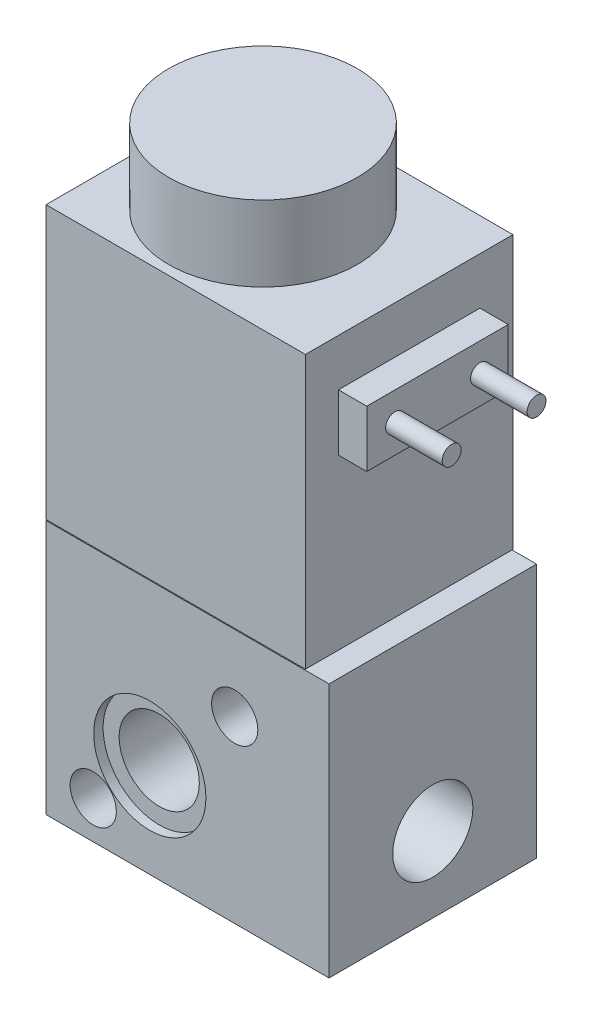
from build123d import *
from build123d.topology import SkipClean

# Parameters (mm, degrees)
ESQUISSE1_W             = 30
ESQUISSE1_H             = 27
ESQUISSE1_R             = 4.25
ESQUISSE1_R_2           = 1.5
BOSS_EXTRU_1_DEPTH      = 11
ESQUISSE1_W_2           = 27.5
ESQUISSE1_H_2           = 28.9
BOSS_EXTRU_1_2_DEPTH    = 11
ESQUISSE2_R             = 2.45
ENL_V_MAT_EXTRU_1_DEPTH = 8
ESQUISSE3_R             = 5.95
ENL_V_MAT_EXTRU_2_DEPTH = 1
ESQUISSE4_R             = 4.25
ENL_V_MAT_EXTRU_3_DEPTH = 8
ESQUISSE5_W             = 7.5
ESQUISSE5_H             = 6
BOSS_EXTRU_2_DEPTH      = 3
ESQUISSE6_R             = 1
BOSS_EXTRU_3_DEPTH      = 6
ESQUISSE9_R             = 10
BOSS_EXTRU_4_DEPTH      = 8


with BuildPart() as part:
    # Esquisse1 → Boss.-Extru.1 (new body)
    with BuildSketch(Plane.XY):
        with Locations((15, 13.5)):
            Rectangle(ESQUISSE1_W, ESQUISSE1_H)
        with Locations((11, 10)):
            Circle(ESQUISSE1_R, mode=Mode.SUBTRACT)
        with Locations((20, 19)):
            Circle(ESQUISSE1_R_2, mode=Mode.SUBTRACT)
        with Locations((5, 4)):
            Circle(ESQUISSE1_R_2, mode=Mode.SUBTRACT)
    extrude(amount=BOSS_EXTRU_1_DEPTH)

    # Esquisse2 → Enlèv. mat.-Extru.1 (cut)
    with BuildSketch(Plane.XY.offset(11)):
        with Locations((20, 19)):
            Circle(ESQUISSE2_R)
        with Locations((5, 4)):
            Circle(ESQUISSE2_R)
    extrude(amount=-ENL_V_MAT_EXTRU_1_DEPTH, mode=Mode.SUBTRACT)

    # Esquisse3 → Enlèv. mat.-Extru.2 (cut)
    with BuildSketch(Plane.XY.offset(11)):
        with Locations((11, 10)):
            Circle(ESQUISSE3_R)
    extrude(amount=-ENL_V_MAT_EXTRU_2_DEPTH, mode=Mode.SUBTRACT)

    # Esquisse4 → Enlèv. mat.-Extru.3 (cut)
    with BuildSketch(Plane(origin=(30, 0, 0), x_dir=(0, 0, -1), z_dir=(1, 0, 0))):
        with Locations((0, 8)):
            Circle(ESQUISSE4_R)
    extrude(amount=-ENL_V_MAT_EXTRU_3_DEPTH, mode=Mode.SUBTRACT)

    # Esquisse7 → Trou taraudé M4x0.71 (revolve, cut)
    with BuildSketch(Plane(origin=(25, 0, 7.5), x_dir=(0, 0, -1), z_dir=(1, 0, 0))):
        Polygon((0, 0), (0, 13.491420021), (1.65, 12.5), (1.65, 0), align=None)
    revolve(axis=Axis((25, -6.35, 7.5), (0, 1, 0)), mode=Mode.SUBTRACT)

    # Sym_trie1 2: part across plane


with BuildPart() as body_2:
    # Esquisse1 → Boss.-Extru.1 2 (new body)
    with BuildSketch(Plane.XY):
        with Locations((13.75, 41.55)):
            Rectangle(ESQUISSE1_W_2, ESQUISSE1_H_2)
    extrude(amount=BOSS_EXTRU_1_2_DEPTH)

    # Esquisse5 → Boss.-Extru.2 (add)
    with BuildSketch(Plane(origin=(27.5, 0, 0), x_dir=(0, 0, -1), z_dir=(1, 0, 0))):
        with Locations((-3.75, 48)):
            Rectangle(ESQUISSE5_W, ESQUISSE5_H)
    extrude(amount=BOSS_EXTRU_2_DEPTH)

    # Symétrie1: body 2 across plane


with BuildPart() as body_3:
    # Esquisse6 → Boss.-Extru.3 (new body)
    with BuildSketch(Plane(origin=(30.5, 0, 0), x_dir=(0, 0, -1), z_dir=(1, 0, 0))):
        with Locations((-4.5, 48)):
            Circle(ESQUISSE6_R)
    extrude(amount=BOSS_EXTRU_3_DEPTH)


with BuildPart() as body_2_1:
    add(body_2.part)
    add(body_2.part.mirror(Plane(origin=(0, 0, 0), x_dir=(1, 0, 0), z_dir=(0, 0, -1))))

    # Esquisse9 → Boss.-Extru.4 (add)
    with BuildSketch(Plane(origin=(0, 56, 0), x_dir=(1, 0, 0), z_dir=(0, 1, 0))):
        with Locations(Location((12, 0, 0), (0, 0, 90))):
            Circle(ESQUISSE9_R)
    extrude(amount=BOSS_EXTRU_4_DEPTH)


with BuildPart() as part_1:
    with SkipClean():  # the faces are left unmerged after this step: merging them gives an invalid solid
        add(part.part)
        add(part.part.mirror(Plane(origin=(0, 0, 0), x_dir=(1, 0, 0), z_dir=(0, 0, -1))))


with BuildPart() as body_4:
    # Symétrie2: mirrored copy
    add(body_3.part.mirror(Plane.XY))


solid = Compound([body_3.part, body_2_1.part, part_1.part, body_4.part])
